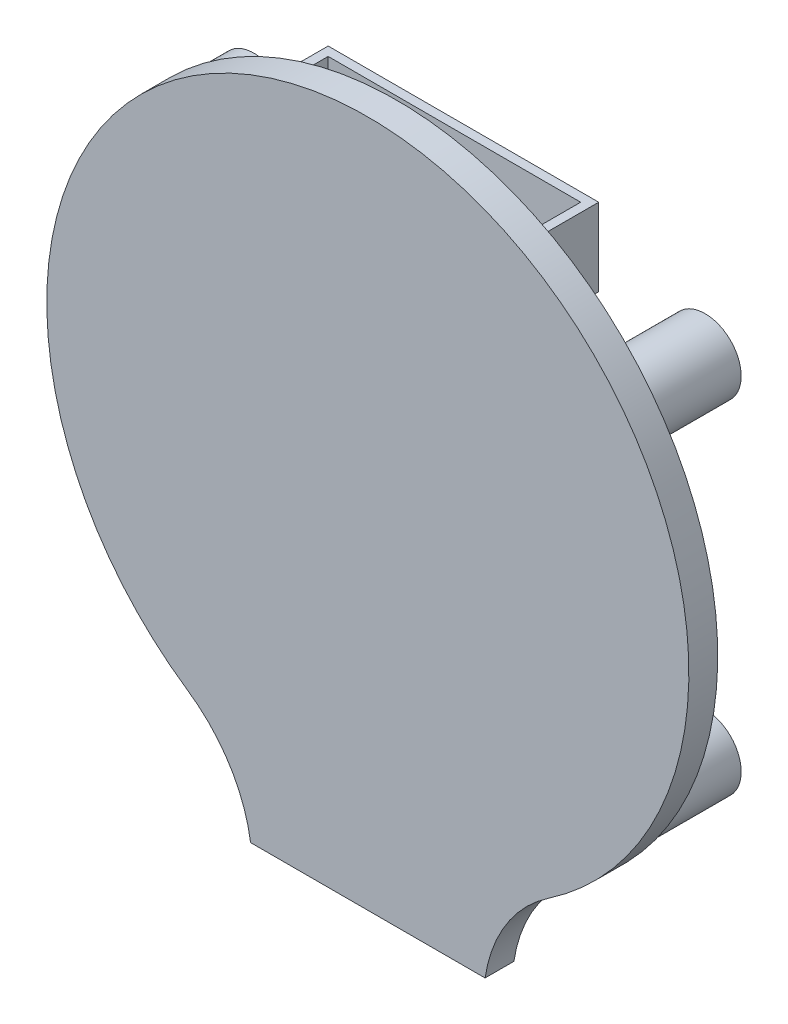
from build123d import *

# Parameters (mm, degrees)
BOSS_EXTRU_1_CONTOUR_CRAN_DEPTH              = 1.6
ENTRETOISES_R                                = 2
BOSS_EXTRU_1_ENTRETOISES_DEPTH               = 4.6
TROUS_VIS_M2_R                               = 1
ENL_V_MAT_EXTRU_1_TROUS_VIS_M2_DEPTH         = 4.6
CONNECTEURS_BLANCS_W                         = 15
CONNECTEURS_BLANCS_H                         = 4.3
CONNECTEURS_BLANCS_W_2                       = 10
BOSS_EXTRU_2_CONNECTEURS_BLANCS_DEPTH        = 3.7
OUVERTURE_GROS_CONNECTEUR_BLANC_W            = 14
OUVERTURE_GROS_CONNECTEUR_BLANC_H            = 2.7
ENL_V_MAT_EXTRU_2_OUVERTURE_GROS_CONNE_DEPTH = 3.7
OUVERTURE_PETIT_CONNECTEUR_BLANC_W           = 9
OUVERTURE_PETIT_CONNECTEUR_BLANC_H           = 2.7
ENL_V_MAT_EXTRU_3_OUVERTURE_PETIT_CONN_DEPTH = 3.7


with BuildPart() as part:
    # Contour_Écran → Boss.-Extru.1_Contour_Écran (new body)
    with BuildSketch(Plane.XY):
        with BuildLine():
            Line((-6.5, -20.3), (6.5, -20.3))
            ThreePointArc((6.5, -20.3), (7.668481961, -17.144005216), (10.005084126, -14.722034222))
            ThreePointArc((10.005084126, -14.722034222), (0, 17.8), (-10.005084126, -14.722034222))
            ThreePointArc((-10.005084126, -14.722034222), (-7.668481961, -17.144005216), (-6.5, -20.3))
        make_face()
    extrude(amount=BOSS_EXTRU_1_CONTOUR_CRAN_DEPTH)

    # Entretoises → Boss.-Extru.1_Entretoises (add)
    with BuildSketch(Plane(origin=(0, 0, 0), x_dir=(-1, 0, 0), z_dir=(0, 0, -1))):
        with Locations((-12.5, 9.5)):
            Circle(ENTRETOISES_R)
        with Locations((12.5, 9.5)):
            Circle(ENTRETOISES_R)
        with Locations((12.5, -9.5)):
            Circle(ENTRETOISES_R)
        with Locations((-12.5, -9.5)):
            Circle(ENTRETOISES_R)
    extrude(amount=BOSS_EXTRU_1_ENTRETOISES_DEPTH)

    # Trous_Vis_M2 → Enlèv. mat.-Extru.1_Trous_Vis_M2 (cut)
    with BuildSketch(Plane(origin=(0, 0, -4.6), x_dir=(-1, 0, 0), z_dir=(0, 0, -1))):
        with Locations((-12.5, 9.5)):
            Circle(TROUS_VIS_M2_R)
        with Locations((12.5, 9.5)):
            Circle(TROUS_VIS_M2_R)
        with Locations((12.5, -9.5)):
            Circle(TROUS_VIS_M2_R)
        with Locations((-12.5, -9.5)):
            Circle(TROUS_VIS_M2_R)
    extrude(amount=-ENL_V_MAT_EXTRU_1_TROUS_VIS_M2_DEPTH, mode=Mode.SUBTRACT)

    # Connecteurs_Blancs → Boss.-Extru.2_Connecteurs_Blancs (add)
    with BuildSketch(Plane(origin=(0, 0, 0), x_dir=(-1, 0, 0), z_dir=(0, 0, -1))):
        with Locations((0, 12.65)):
            Rectangle(CONNECTEURS_BLANCS_W, CONNECTEURS_BLANCS_H)
        with Locations((0, -6.15)):
            Rectangle(CONNECTEURS_BLANCS_W_2, CONNECTEURS_BLANCS_H)
    extrude(amount=BOSS_EXTRU_2_CONNECTEURS_BLANCS_DEPTH)

    # Ouverture_gros_connecteur_blanc → Enlèv. mat.-Extru.2_Ouverture_gros_connecteur_blanc (cut)
    with BuildSketch(Plane(origin=(0, 14.8, 0), x_dir=(1, 0, 0), z_dir=(0, 1, 0))):
        with Locations((0, 1.85)):
            Rectangle(OUVERTURE_GROS_CONNECTEUR_BLANC_W, OUVERTURE_GROS_CONNECTEUR_BLANC_H)
    extrude(amount=-ENL_V_MAT_EXTRU_2_OUVERTURE_GROS_CONNE_DEPTH, mode=Mode.SUBTRACT)

    # Ouverture_petit_connecteur_blanc → Enlèv. mat.-Extru.3_Ouverture_petit_connecteur_blanc (cut)
    with BuildSketch(Plane(origin=(0, -4, 0), x_dir=(1, 0, 0), z_dir=(0, 1, 0))):
        with Locations((0, 1.85)):
            Rectangle(OUVERTURE_PETIT_CONNECTEUR_BLANC_W, OUVERTURE_PETIT_CONNECTEUR_BLANC_H)
    extrude(amount=-ENL_V_MAT_EXTRU_3_OUVERTURE_PETIT_CONN_DEPTH, mode=Mode.SUBTRACT)


solid = part.part
